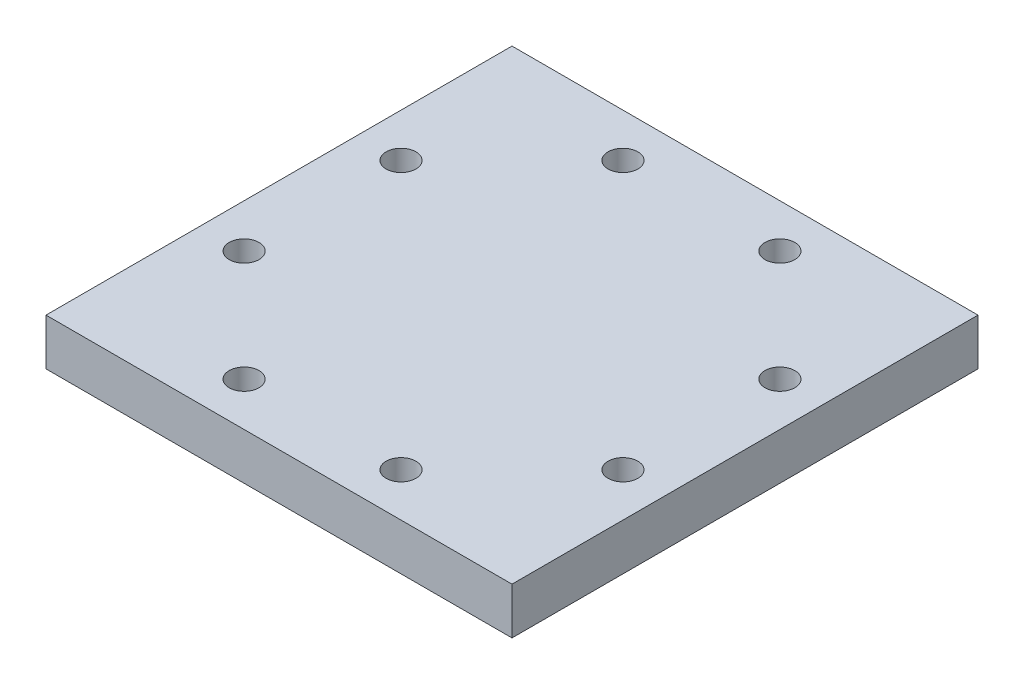
from build123d import *

# Parameters (mm, degrees)
ESQUISSE1_W        = 50
ESQUISSE1_H        = 50
BOSS_EXTRU_1_DEPTH = 5
D_GAGEMENT_M31_D   = 3.2


with BuildPart() as part:
    # Esquisse1 → Boss.-Extru.1 (new body)
    with BuildSketch(Plane(origin=(0, 0, 0), x_dir=(1, 0, 0), z_dir=(0, 1, 0))):
        Rectangle(ESQUISSE1_W, ESQUISSE1_H)
    extrude(amount=BOSS_EXTRU_1_DEPTH)

    # Dégagement M31 (through all)
    with Locations(Plane(origin=(0, 5, 0), x_dir=(1, 0, 0), z_dir=(0, 1, 0))):
        with Locations((20.325349715, 8.419035512), (8.419035512, 20.325349715), (-8.419035512, 20.325349715), (-20.325349715, 8.419035512), (-20.325349715, -8.419035512), (-8.419035512, -20.325349715), (8.419035512, -20.325349715), (20.325349715, -8.419035512)):
            Hole(D_GAGEMENT_M31_D / 2)


solid = part.part
